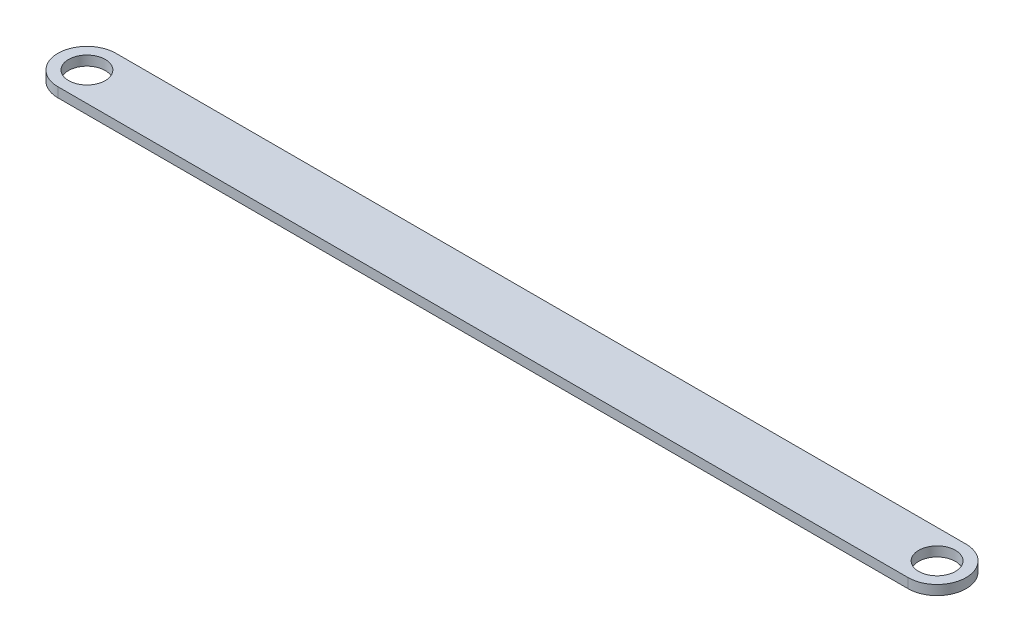
from build123d import *

# Parameters (mm, degrees)
SALIENTE_EXTRUIR1_DEPTH = 2.5
CROQUIS2_R              = 4.75
CORTAR_EXTRUIR1_DEPTH   = 118.765657133


with BuildPart() as part:
    # Croquis1 → Saliente-Extruir1 (new body)
    with BuildSketch(Plane(origin=(0, 0, 0), x_dir=(1, 0, 0), z_dir=(0, 1, 0))):
        with BuildLine():
            Line((-110, 7.5), (110, 7.5))
            ThreePointArc((110, 7.5), (117.5, 0), (110, -7.5))
            Line((110, -7.5), (-110, -7.5))
            ThreePointArc((-110, -7.5), (-117.5, 0), (-110, 7.5))
        make_face()
    extrude(amount=SALIENTE_EXTRUIR1_DEPTH)

    # Croquis2 → Cortar-Extruir1 (cut, through all)
    with BuildSketch(Plane(origin=(0, 2.5, 0), x_dir=(1, 0, 0), z_dir=(0, 1, 0))):
        with Locations(Location((-110, 0, 0), (0, 0, 270))):
            Circle(CROQUIS2_R)
        with Locations(Location((110, 0, 0), (0, 0, 270))):
            Circle(CROQUIS2_R)
    extrude(amount=-CORTAR_EXTRUIR1_DEPTH, mode=Mode.SUBTRACT)


solid = part.part
